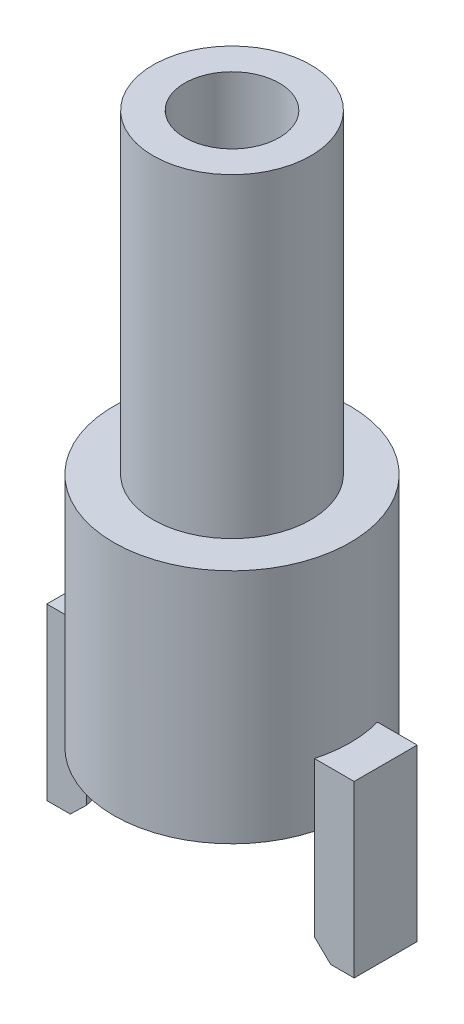
from build123d import *

# Parameters (mm, degrees)
PIN_R                     = 6.35
PIN_R_2                   = 3.81
BOSS_EXTRUDE4_DEPTH       = 25.4
HOLLOW_CYL_R              = 9.525
HOLLOW_CYL_R_2            = 7.62
BOSS_EXTRUDE5_DEPTH       = 19.05
SKETCH4_R                 = 7.62
BOSS_EXTRUDE7_DEPTH       = 2.54
BOSS_EXTRUDE9_DEPTH       = 7.62
BOSS_EXTRUDE9_2_DEPTH     = 7.62
BOSS_EXTRUDE10_DEPTH      = 8.636
BOSS_EXTRUDE10_DEPTH_BACK = 5.08
CHAMFER2_SIZE             = 1.27
CHAMFER4_SIZE             = 1.27


with BuildPart() as part:
    # Pin → Boss-Extrude4 (new body)
    with BuildSketch(Plane(origin=(0, 0, 0), x_dir=(1, 0, 0), z_dir=(0, 1, 0))):
        Circle(PIN_R)
        Circle(PIN_R_2, mode=Mode.SUBTRACT)
    extrude(amount=BOSS_EXTRUDE4_DEPTH)



with BuildPart() as body_2:
    # Hollow Cyl → Boss-Extrude5 (new body)
    with BuildSketch(Plane(origin=(0, 0, 0), x_dir=(1, 0, 0), z_dir=(0, 1, 0))):
        Circle(HOLLOW_CYL_R)
        Circle(HOLLOW_CYL_R_2, mode=Mode.SUBTRACT)
    extrude(amount=-BOSS_EXTRUDE5_DEPTH)


with BuildPart() as part_1:
    add(part.part)

    add(body_2.part)  # Boss-Extrude7 merges body 2
    # Sketch4 → Boss-Extrude7 (add)
    with BuildSketch(Plane(origin=(0, 0, 0), x_dir=(1, 0, 0), z_dir=(0, 1, 0))):
        Circle(SKETCH4_R)
    extrude(amount=-BOSS_EXTRUDE7_DEPTH)



with BuildPart() as body_2_2:
    # Sketch6 → Boss-Extrude9 (new body)
    with BuildSketch(Plane(origin=(0, -19.05, 0), x_dir=(-1, 0, 0), z_dir=(0, -1, 0))):
        with BuildLine():
            Line((9.180088507, -2.54), (12.3825, -2.54))
            Line((12.3825, -2.54), (12.3825, 2.54))
            Line((12.3825, 2.54), (9.180088507, 2.54))
            ThreePointArc((9.180088507, 2.54), (9.525, 0), (9.180088507, -2.54))
        make_face()
    extrude(amount=BOSS_EXTRUDE9_DEPTH)


with BuildPart() as body_3:
    # Sketch6 → Boss-Extrude9 2 (new body)
    with BuildSketch(Plane(origin=(0, -19.05, 0), x_dir=(-1, 0, 0), z_dir=(0, -1, 0))):
        with BuildLine():
            Line((-12.3825, -2.54), (-9.180088507, -2.54))
            ThreePointArc((-9.180088507, -2.54), (-9.525, 0), (-9.180088507, 2.54))
            Line((-9.180088507, 2.54), (-12.3825, 2.54))
            Line((-12.3825, 2.54), (-12.3825, -2.54))
        make_face()
    extrude(amount=BOSS_EXTRUDE9_2_DEPTH)


with BuildPart() as part_2:
    add(part_1.part)

    add(body_2_2.part)  # Boss-Extrude10 merges body 2 2

    add(body_3.part)  # Boss-Extrude10 merges body 3
    # Sketch6<5> → Boss-Extrude10 (add, two sides: drawn at the far end of the back side and taken through both)
    with BuildSketch(Plane(origin=(0, -19.05, 0), x_dir=(-1, 0, 0), z_dir=(0, -1, 0)).offset(-BOSS_EXTRUDE10_DEPTH_BACK)):
        with BuildLine():
            Line((9.180088507, -2.54), (12.3825, -2.54))
            Line((12.3825, -2.54), (12.3825, 2.54))
            Line((12.3825, 2.54), (9.180088507, 2.54))
            ThreePointArc((9.180088507, 2.54), (9.525, 0), (9.180088507, -2.54))
        make_face()
        with BuildLine():
            Line((-12.3825, -2.54), (-9.180088507, -2.54))
            ThreePointArc((-9.180088507, -2.54), (-9.525, 0), (-9.180088507, 2.54))
            Line((-9.180088507, 2.54), (-12.3825, 2.54))
            Line((-12.3825, 2.54), (-12.3825, -2.54))
        make_face()
    extrude(amount=BOSS_EXTRUDE10_DEPTH + BOSS_EXTRUDE10_DEPTH_BACK)

    # Chamfer2
    chamfer2_edges = [part_2.edges().sort_by_distance(p)[0] for p in [
        (9.525, -27.686, 0),
    ]]
    chamfer(chamfer2_edges, length=CHAMFER2_SIZE)

    # Chamfer4
    chamfer4_edges = [part_2.edges().sort_by_distance(p)[0] for p in [
        (-9.525, -27.686, 0),
    ]]
    chamfer(chamfer4_edges, length=CHAMFER4_SIZE)


solid = part_2.part
